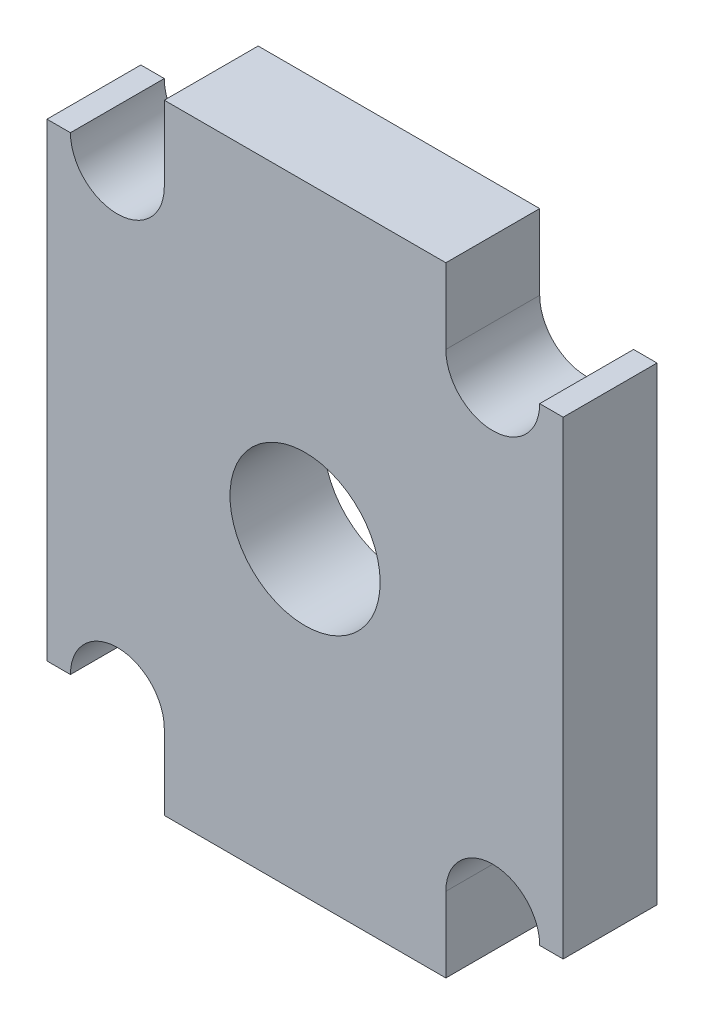
from build123d import *

# Parameters (mm, degrees)
SKETCH1_R           = 1.6
BOSS_EXTRUDE1_DEPTH = 2


with BuildPart() as part:
    # Sketch1 → Boss-Extrude1 (new body)
    with BuildSketch(Plane.XY):
        with BuildLine():
            Line((115.05, 10), (115.05, 11.6))
            Line((115.05, 11.6), (121.05, 11.6))
            Line((121.05, 11.6), (121.05, 10))
            ThreePointArc((121.05, 10), (122.05, 9), (123.05, 10))
            Line((123.05, 10), (123.55, 10))
            Line((123.55, 10), (123.55, 0))
            Line((123.55, 0), (123.05, 0))
            ThreePointArc((123.05, 0), (122.05, 1), (121.05, 0))
            Line((121.05, 0), (121.05, -1.6))
            Line((121.05, -1.6), (115.05, -1.6))
            Line((115.05, -1.6), (115.05, 0))
            ThreePointArc((115.05, 0), (114.05, 1), (113.05, 0))
            Line((113.05, 0), (112.55, 0))
            Line((112.55, 0), (112.55, 10))
            Line((112.55, 10), (113.05, 10))
            ThreePointArc((113.05, 10), (114.05, 9), (115.05, 10))
        make_face()
        with Locations((118.05, 5)):
            Circle(SKETCH1_R, mode=Mode.SUBTRACT)
    extrude(amount=BOSS_EXTRUDE1_DEPTH)


solid = part.part
